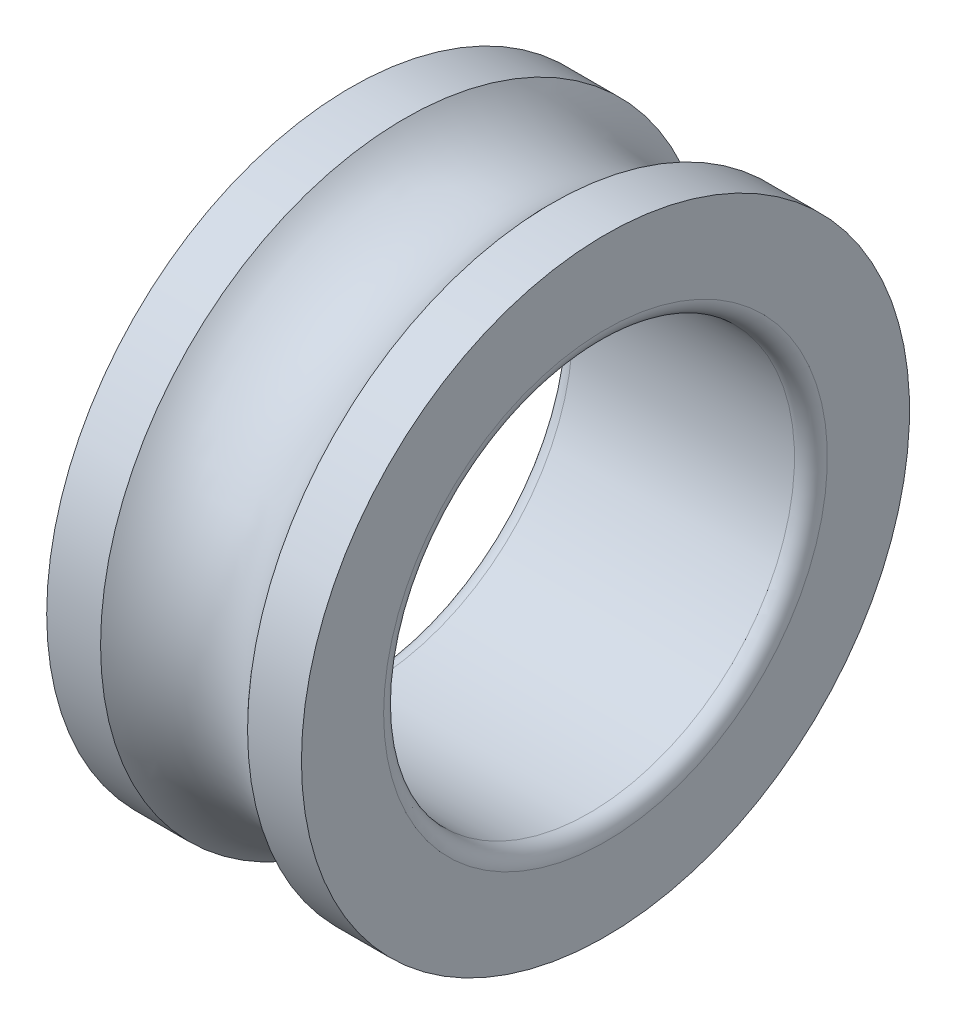
from build123d import *

# Parameters (mm, degrees)
FILLET_1_R = 2


with BuildPart() as part:
    # 草图1 → 旋转1 (revolve)
    with BuildSketch(Plane.XY, mode=Mode.PRIVATE) as revolve_1_sk:
        with BuildLine():
            Line((-15.5, 37), (-8.94427191, 37))
            ThreePointArc((-8.94427191, 37), (0, 33), (8.94427191, 37))
            Line((8.94427191, 37), (15.5, 37))
            Line((15.5, 37), (15.5, 25))
            Line((15.5, 25), (-15.5, 25))
            Line((-15.5, 25), (-15.5, 37))
        make_face()
    revolve(revolve_1_sk.sketch.rotate(Axis((0, 0, 0), (1, 0, 0)), 90), axis=Axis((0, 0, 0), (1, 0, 0)))

    # 圆角1
    fillet_1_edges = [part.edges().sort_by_distance(p)[0] for p in [
        (15.5, 0, -25),
        (-15.5, 0, -25),
    ]]
    fillet(fillet_1_edges, radius=FILLET_1_R)


solid = part.part
